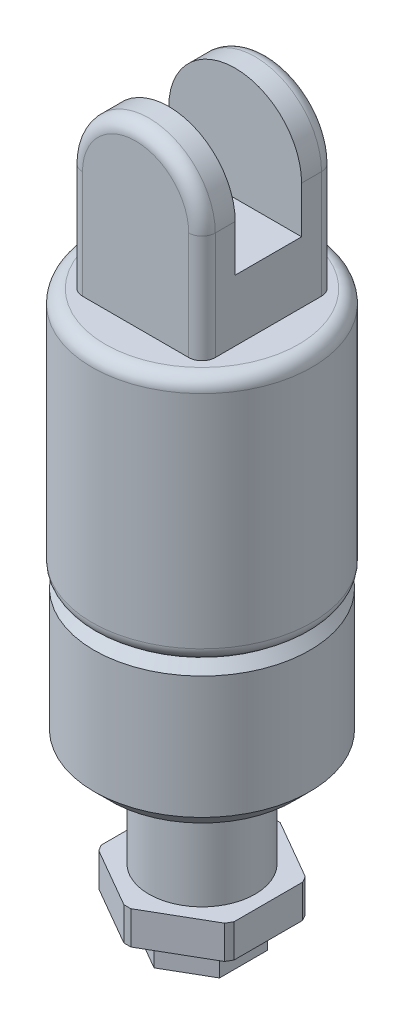
from build123d import *

# Parameters (mm, degrees)
FILLET_ROUND_R          = 0.8
CHAMF_PLASTIC_BASE_SIZE = 1
SKETCH3_OUTSIDE_W       = 23.904
SKETCH3_OUTSIDE_H       = 23.904
CUT_8MM_HEX_DEPTH       = 3
SKETCH4_OUTSIDE_W       = 23.904
SKETCH4_OUTSIDE_H       = 23.904
CUT_5MM_HEX_DEPTH       = 2
BOSS_PIVOT_DEPTH        = 4
FILLET_PIVOT_R          = 0.8
CUT_EXTRUDE1_DEPTH      = 36.749562971
CUT_EXTRUDE1_DEPTH_BACK = 36.749562971
SKETCH6_W               = 4
SKETCH6_H               = 6.8
SKETCH7_R               = 1.3
CUT_EXTRUDE2_DEPTH      = 5


with BuildPart() as part:
    # Sketch1 → revolve body (revolve)
    with BuildSketch(Plane.XY, mode=Mode.PRIVATE) as revolve_body_sk:
        Polygon((6.5, 0), (6.5, 8.375), (6, 9), (6.625, 9.5), (6.625, 24), (0, 24), (0, 0), align=None)
    revolve(revolve_body_sk.sketch.rotate(Axis((0, 0, 0), (0, 1, 0)), 90), axis=Axis((0, 0, 0), (0, 1, 0)))

    # fillet round
    fillet_round_edges = [part.edges().sort_by_distance(p)[0] for p in [
        (0, 9.5, 6.625),
        (0, 24, 6.625),
    ]]
    fillet(fillet_round_edges, radius=FILLET_ROUND_R)

    # chamf plastic base
    chamf_plastic_base_edges = [part.edges().sort_by_distance(p)[0] for p in [
        (0, 0, 6.5),
    ]]
    chamfer(chamf_plastic_base_edges, length=CHAMF_PLASTIC_BASE_SIZE)

    # Sketch2 → revolve threaded body (revolve)
    with BuildSketch(Plane.XY, mode=Mode.PRIVATE) as revolve_threaded_body_sk:
        Polygon((3.2, 0), (3.2, -6), (4.5, -6), (4.5, -8), (3.25, -8), (3.25, -10), (1.3, -10), (1.3, -15), (0, -15), (0, 0), align=None)
    revolve(revolve_threaded_body_sk.sketch.rotate(Axis((0, 0, 0), (0, -1, 0)), 90), axis=Axis((0, 0, 0), (0, -1, 0)))

    # Sketch3 outside → cut 8mm hex (cut)
    with BuildSketch(Plane.XZ.offset(8)):
        Rectangle(SKETCH3_OUTSIDE_W, SKETCH3_OUTSIDE_H)
        Polygon((0, 4.618802154), (-4, 2.309401077), (-4, -2.309401077), (0, -4.618802154), (4, -2.309401077), (4, 2.309401077), align=None, mode=Mode.SUBTRACT)
    extrude(amount=-CUT_8MM_HEX_DEPTH, mode=Mode.SUBTRACT)

    # Sketch4 outside → cut 5mm hex (cut)
    with BuildSketch(Plane.XZ.offset(10)):
        Rectangle(SKETCH4_OUTSIDE_W, SKETCH4_OUTSIDE_H)
        Polygon((0, 2.886751346), (-2.5, 1.443375673), (-2.5, -1.443375673), (0, -2.886751346), (2.5, -1.443375673), (2.5, 1.443375673), align=None, mode=Mode.SUBTRACT)
    extrude(amount=-CUT_5MM_HEX_DEPTH, mode=Mode.SUBTRACT)

    # Sketch5 → boss pivot (add, symmetric)
    with BuildSketch(Plane.XY):
        with BuildLine():
            Line((-4, 24), (4, 24))
            Line((4, 24), (4, 30.5))
            ThreePointArc((4, 30.5), (0, 34.5), (-4, 30.5))
            Line((-4, 30.5), (-4, 24))
        make_face()
    extrude(amount=BOSS_PIVOT_DEPTH, both=True)

    # fillet pivot
    fillet_pivot_edges = [part.edges().sort_by_distance(p)[0] for p in [
        (-4, 27.25, -4),
        (4, 27.25, -4),
        (0, 34.5, -4),
        (-4, 27.25, 4),
        (4, 27.25, 4),
        (0, 34.5, 4),
    ]]
    fillet(fillet_pivot_edges, radius=FILLET_PIVOT_R)

    # Sketch6 → Cut-Extrude1 (cut, two sides: drawn at the far end of the back side and taken through both)
    with BuildSketch(Plane(origin=(0, 0, 0), x_dir=(0, 0, -1), z_dir=(1, 0, 0)).offset(-CUT_EXTRUDE1_DEPTH_BACK)):
        with Locations((0, 31.1)):
            Rectangle(SKETCH6_W, SKETCH6_H)
    extrude(amount=CUT_EXTRUDE1_DEPTH + CUT_EXTRUDE1_DEPTH_BACK, mode=Mode.SUBTRACT)

    # Sketch7 → Cut-Extrude2 (cut)
    with BuildSketch(Plane.XZ.offset(15)):
        Circle(SKETCH7_R)
    extrude(amount=-CUT_EXTRUDE2_DEPTH, mode=Mode.SUBTRACT)


solid = part.part
